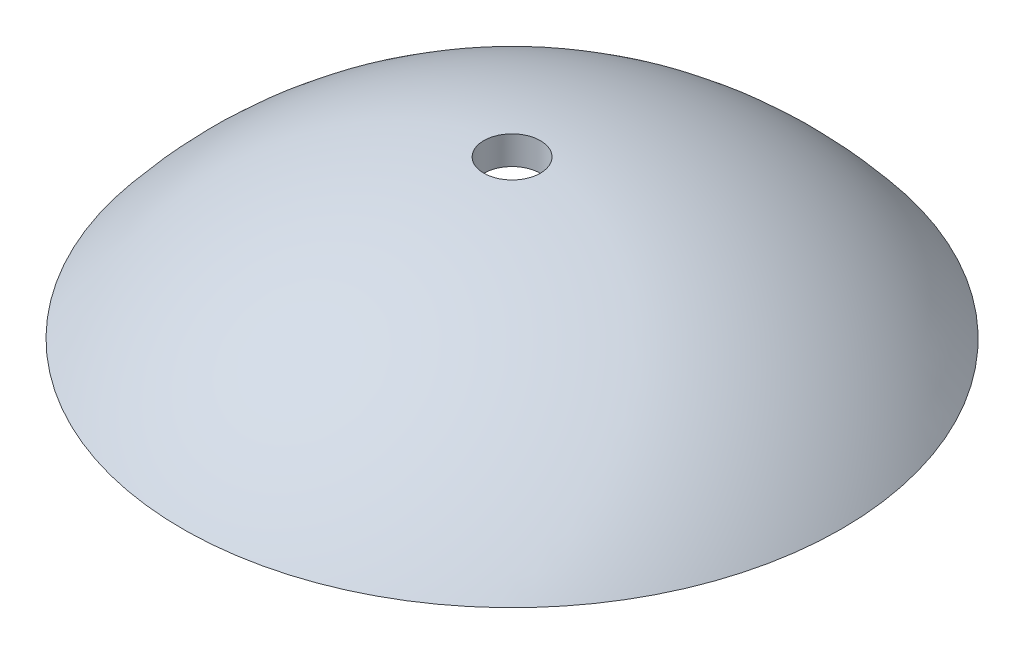
from build123d import *

# Parameters (mm, degrees)
SKETCH3_W          = 65.903471667
SKETCH3_H          = 42.94663955
CUT_EXTRUDE1_DEPTH = 25
SKETCH5_R          = 1.5
CUT_EXTRUDE2_DEPTH = 25


with BuildPart() as part:
    # Sketch1 → Revolve1 (revolve)
    with BuildSketch(Plane.XY):
        with BuildLine():
            Line((0, 22.4), (0, 0))
            Line((0, 0), (0, -22.4))
            ThreePointArc((0, -22.4), (-22.4, 0), (0, 22.4))
        make_face()
    revolve(axis=Axis((0, 51.787709497, 0), (0, -1, 0)))

    # Sketch3 → Cut-Extrude1 (cut, symmetric)
    with BuildSketch(Plane.XY):
        with Locations((-0.554743028, -7.473319775)):
            Rectangle(SKETCH3_W, SKETCH3_H)
    extrude(amount=CUT_EXTRUDE1_DEPTH, both=True, mode=Mode.SUBTRACT)

    # Sketch4 → Cut-Revolve1 (revolve, cut)
    with BuildSketch(Plane.XY):
        with BuildLine():
            Line((0, 0), (0, 20.9))
            ThreePointArc((0, 20.9), (-20.9, 0), (0, -20.9))
            Line((0, -20.9), (0, 0))
        make_face()
    revolve(axis=Axis((0, 39.939026177, 0), (0, -1, 0)), mode=Mode.SUBTRACT)

    # Sketch5 → Cut-Extrude2 (cut, symmetric)
    with BuildSketch(Plane(origin=(0, 0, 0), x_dir=(1, 0, 0), z_dir=(0, 1, 0))):
        Circle(SKETCH5_R)
    extrude(amount=CUT_EXTRUDE2_DEPTH, both=True, mode=Mode.SUBTRACT)


solid = part.part
